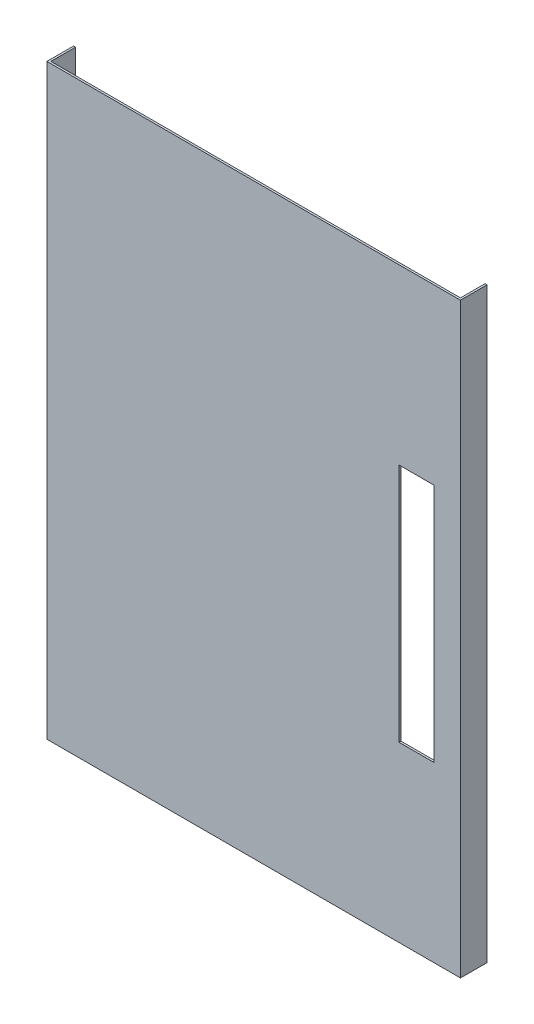
from build123d import *

# Parameters (mm, degrees)
PRESS_KOVA_KAPAGI_KAPAK_1_START = 1340
PRESS_KOVA_KAPAGI_KAPAK_1_DEPTH = 440
PRESS_KOVA_KAPAGI_KAPAK_2_START = 27
SKETCH2_W                       = 26
SKETCH2_H                       = 180
PRESS_KOVA_KAPAGI_KAPAK_2_DEPTH = 14


with BuildPart() as part:
    # Sketch1 → PRESS_kova_kapagi_kapak_1 (new body)
    with BuildSketch(Plane(origin=(0, 0, 0), x_dir=(1, 0, 0), z_dir=(0, 1, 0)).offset(PRESS_KOVA_KAPAGI_KAPAK_1_START)):
        Polygon((30, -40), (30, -20), (31.5, -20), (31.5, -38.5), (338.5, -38.5), (338.5, -20), (340, -20), (340, -40), align=None)
    extrude(amount=PRESS_KOVA_KAPAGI_KAPAK_1_DEPTH)

    # Sketch2 → PRESS_kova_kapagi_kapak_2 (cut)
    with BuildSketch(Plane.XY.offset(PRESS_KOVA_KAPAGI_KAPAK_2_START)):
        with Locations((307, 1560)):
            Rectangle(SKETCH2_W, SKETCH2_H)
    extrude(amount=PRESS_KOVA_KAPAGI_KAPAK_2_DEPTH, mode=Mode.SUBTRACT)


solid = part.part
